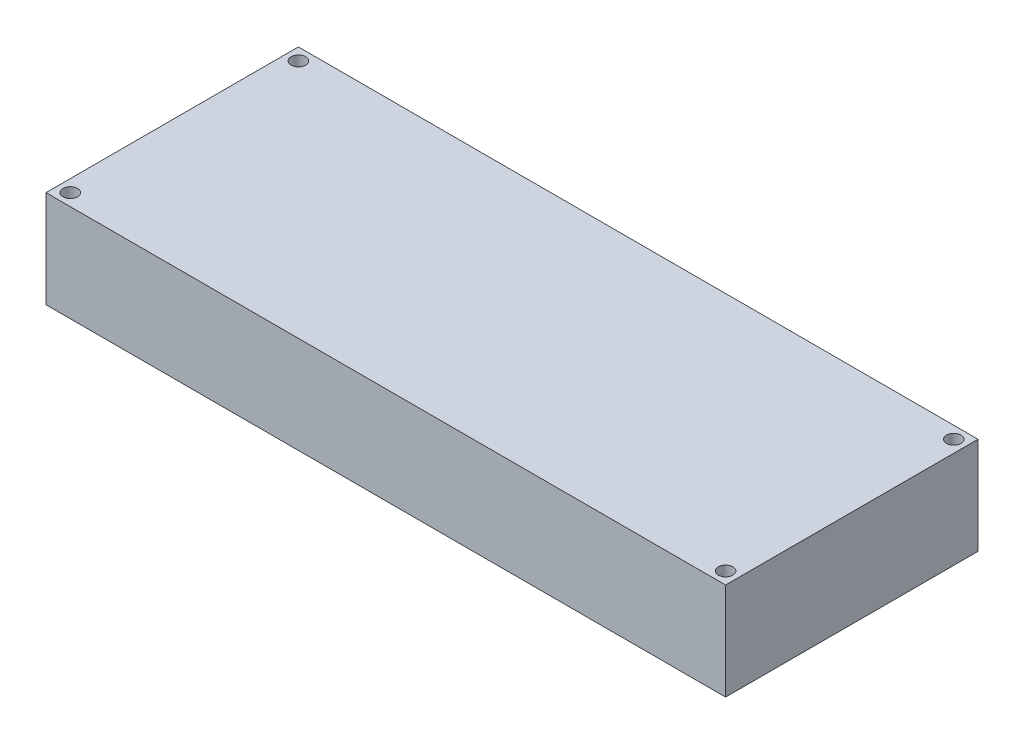
from build123d import *

# Parameters (mm, degrees)
SZKIC1_R                    = 1.5
DODANIE_WYCI_GNI_CIE1_DEPTH = 20


with BuildPart() as part:
    # Szkic1 → Dodanie-wyciągnięcie1 (new body)
    with BuildSketch(Plane(origin=(0, 0, 0), x_dir=(1, 0, 0), z_dir=(0, 1, 0))):
        Polygon((0, 52), (0, 0), (70, 0), (137.042253521, 0), (140, 0), (140, 52), align=None)
        with Locations(Location((2.5, 2.5, 0), (0, 0, 270))):
            Circle(SZKIC1_R, mode=Mode.SUBTRACT)
        with Locations(Location((137.5, 2.5, 0), (0, 0, 270))):
            Circle(SZKIC1_R, mode=Mode.SUBTRACT)
        with Locations(Location((2.5, 49.5, 0), (0, 0, 270))):
            Circle(SZKIC1_R, mode=Mode.SUBTRACT)
        with Locations(Location((137.5, 49.5, 0), (0, 0, 270))):
            Circle(SZKIC1_R, mode=Mode.SUBTRACT)
    extrude(amount=DODANIE_WYCI_GNI_CIE1_DEPTH)


solid = part.part
